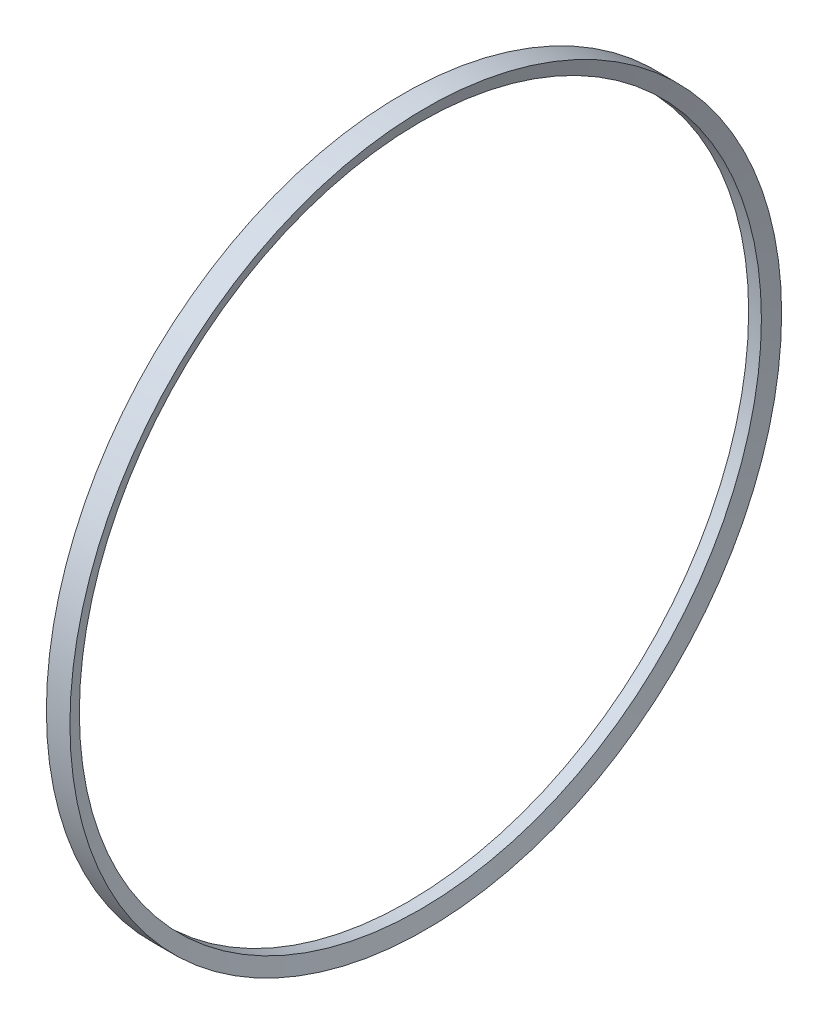
from build123d import *


with BuildPart() as part:
    # Sketch1 → Revolve1 (revolve)
    with BuildSketch(Plane.XY, mode=Mode.PRIVATE) as revolve1_sk:
        Polygon((-6.35, 192), (6.35, 192), (3.438238126, 184), (-3.438238126, 184), align=None)
    revolve(revolve1_sk.sketch.rotate(Axis((0, 0, 0), (1, 0, 0)), 90), axis=Axis((0, 0, 0), (1, 0, 0)))


solid = part.part
